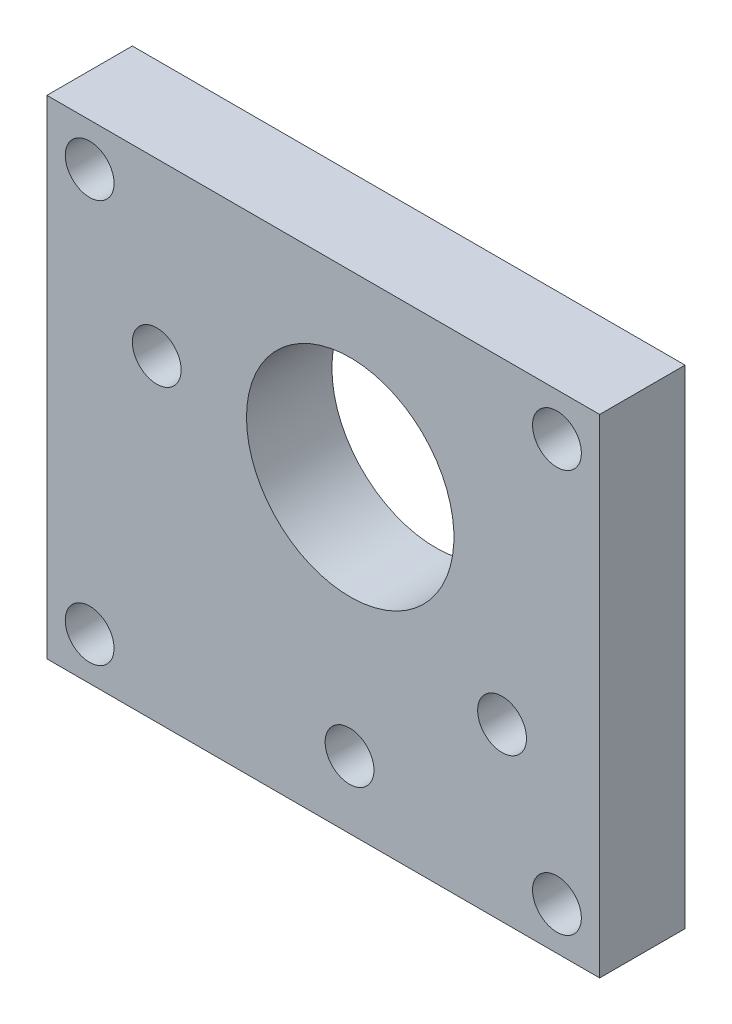
from build123d import *

# Parameters (mm, degrees)
ESQUISSE1_W                                       = 45.3
ESQUISSE1_H                                       = 40
BOSS_EXTRU_1_DEPTH                                = 7
CHAMBRAGE_POUR_VIS_SIX_PANS_CREUX_M42_D           = 4
CHAMBRAGE_POUR_VIS_SIX_PANS_CREUX_M42_CBORE_D     = 6
CHAMBRAGE_POUR_VIS_SIX_PANS_CREUX_M42_CBORE_DEPTH = 3
ESQUISSE8_R                                       = 8.5
ENL_V_MAT_EXTRU_1_DEPTH                           = 7
CHAMBRAGE_POUR_VIS_SIX_PANS_CREUX_M43_D           = 4
CHAMBRAGE_POUR_VIS_SIX_PANS_CREUX_M43_CBORE_D     = 6
CHAMBRAGE_POUR_VIS_SIX_PANS_CREUX_M43_CBORE_DEPTH = 3


with BuildPart() as part:
    # Esquisse1 → Boss.-Extru.1 (new body)
    with BuildSketch(Plane.XY):
        with Locations((3.477385892, 0.545435685)):
            Rectangle(ESQUISSE1_W, ESQUISSE1_H)
    extrude(amount=-BOSS_EXTRU_1_DEPTH)

    # Chambrage pour vis à six pans creux M42 (through all)
    with Locations(Plane(origin=(0, 0, -7), x_dir=(-1, 0, 0), z_dir=(0, 0, -1))):
        with Locations((-22.627385892, 17.045435685), (15.672614108, 17.045435685), (15.672614108, -15.954564315), (-22.627385892, -15.954564315)):
            CounterBoreHole(CHAMBRAGE_POUR_VIS_SIX_PANS_CREUX_M42_D / 2, CHAMBRAGE_POUR_VIS_SIX_PANS_CREUX_M42_CBORE_D / 2, CHAMBRAGE_POUR_VIS_SIX_PANS_CREUX_M42_CBORE_DEPTH)

    # Esquisse8 → Enlèv. mat.-Extru.1 (cut)
    with BuildSketch(Plane(origin=(0, 0, -7), x_dir=(-1, 0, 0), z_dir=(0, 0, -1))):
        with Locations((-5.682958625, 5.866379902)):
            Circle(ESQUISSE8_R)
    extrude(amount=-ENL_V_MAT_EXTRU_1_DEPTH, mode=Mode.SUBTRACT)

    # Chambrage pour vis à six pans creux M43 (through all)
    with Locations(Plane(origin=(0, 0, -7), x_dir=(-1, 0, 0), z_dir=(0, 0, -1))):
        with Locations((-5.627385892, -13.954564315), (-18.127385892, -5.454564315), (10.172614108, 6.545435685)):
            CounterBoreHole(CHAMBRAGE_POUR_VIS_SIX_PANS_CREUX_M43_D / 2, CHAMBRAGE_POUR_VIS_SIX_PANS_CREUX_M43_CBORE_D / 2, CHAMBRAGE_POUR_VIS_SIX_PANS_CREUX_M43_CBORE_DEPTH)


solid = part.part
